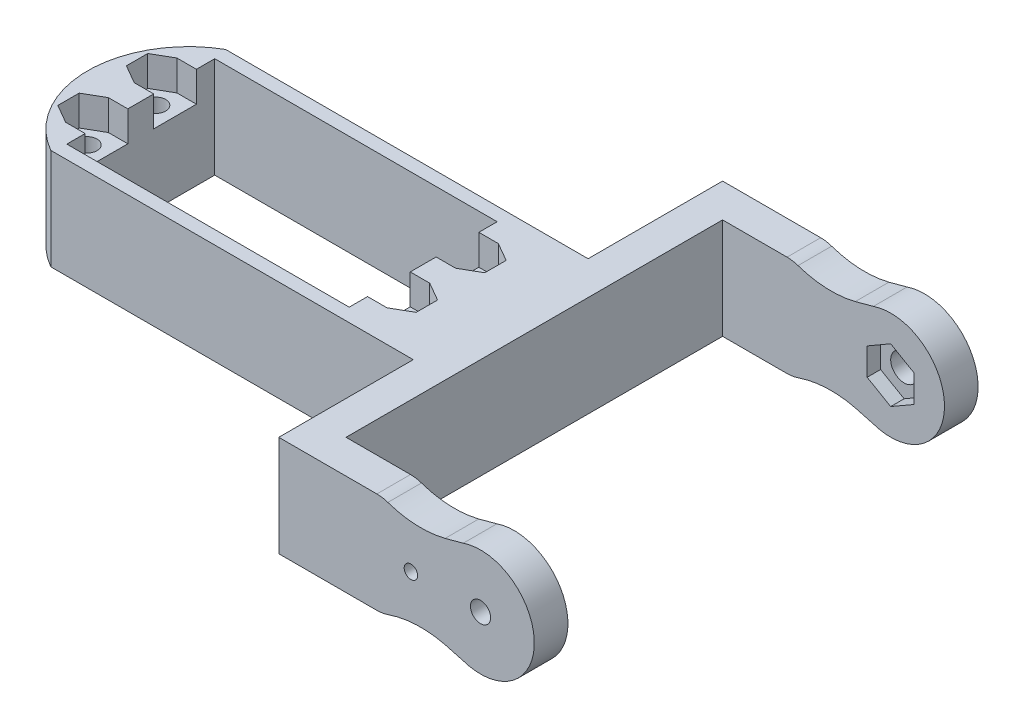
from build123d import *

# Parameters (mm, degrees)
ESQUISSE1_W                   = 80
ESQUISSE1_H                   = 26
BOSS_EXTRU_1_DEPTH            = 5
ESQUISSE4_W                   = 15
ESQUISSE4_H                   = 21
BOSS_EXTRU_2_DEPTH            = 23
ESQUISSE6_R                   = 1.9
ENL_V_MAT_EXTRU_1_DEPTH       = 23
ESQUISSE7_R                   = 2.5
ENL_V_MAT_EXTRU_2_DEPTH       = 33
ESQUISSE8_W                   = 23.844388633
ESQUISSE8_H                   = 15
ENL_V_MAT_EXTRU_3_DEPTH       = 20
ENL_V_MAT_EXTRU_4_DEPTH       = 20
ENL_V_MAT_EXTRU_5_DEPTH       = 25
ENL_V_MAT_EXTRU_7_DEPTH       = 25
ENL_V_MAT_EXTRU_8_DEPTH       = 1
BOSS_EXTRU_3_DEPTH            = 2
ESQUISSE15_R                  = 1.5
ENL_V_MAT_EXTRU_9_DEPTH       = 19
ENL_V_MAT_EXTRU_10_DEPTH      = 19
ESQUISSE17_W                  = 42
ESQUISSE17_H                  = 22
ENL_V_MAT_EXTRU_11_DEPTH      = 19
ENL_V_MAT_EXTRU_12_DEPTH      = 2
BOSS_EXTRU_4_DEPTH            = 22
BOSS_EXTRU_5_DEPTH            = 10
ESQUISSE25_R                  = 8
ENL_V_MAT_EXTRU_13_DEPTH      = 5
ESQUISSE26_R                  = 6
ENL_V_MAT_EXTRU_14_DEPTH      = 5
ENL_V_MAT_EXTRU_15_DEPTH      = 1
BOSS_EXTRU_6_DEPTH            = 2
ENL_V_MAT_EXTRU_16_DEPTH      = 25
ENL_V_MAT_EXTRU_16_DEPTH_BACK = 25
BOSS_EXTRU_7_START            = -5
BOSS_EXTRU_7_DEPTH            = 5
BOSS_EXTRU_8_DEPTH            = 23
BOSS_EXTRU_8_DEPTH_BACK       = 43
BOSS_EXTRU_10_DEPTH           = 45
BOSS_EXTRU_10_DEPTH_BACK      = 3
BOSS_EXTRU_12_DEPTH           = 5
ENL_V_START                   = -45
ENL_V_MAT_EXTRU_18_DEPTH      = 45
ESQUISSE41_W                  = 5
ESQUISSE41_H                  = 12
BOSS_EXTRU_13_DEPTH           = 37
ENL_V_MAT_EXTRU_19_DEPTH      = 2
ESQUISSE43_R                  = 2
ENL_V_MAT_EXTRU_20_DEPTH      = 18
ESQUISSE44_W                  = 24.601862261
ESQUISSE44_H                  = 37.157295415
ENL_V_MAT_EXTRU_21_DEPTH      = 18
BOSS_EXTRU_14_START           = -5
ESQUISSE45_R                  = 1.5
ESQUISSE45_R_2                = 1
BOSS_EXTRU_14_DEPTH           = 5
ENL_V_START_2                 = -29
ENL_V_MAT_EXTRU_22_DEPTH      = 29
ESQUISSE47_W                  = 0.149289857
ESQUISSE47_H                  = 9
ENL_V_MAT_EXTRU_23_DEPTH      = 1
ENL_V_MAT_EXTRU_24_DEPTH      = 21
ENL_V_MAT_EXTRU_24_DEPTH_BACK = 15
ESQUISSE48_W                  = 0.149289857
ESQUISSE48_H                  = 1
ENL_V_MAT_EXTRU_25_DEPTH      = 21
BOSS_EXTRU_15_DEPTH           = 12
ENL_V_MAT_EXTRU_26_DEPTH      = 13
ENL_V_MAT_EXTRU_26_DEPTH_BACK = 2
ENL_V_MAT_EXTRU_27_DEPTH      = 38
ENL_V_MAT_EXTRU_27_DEPTH_BACK = 40
ESQUISSE52_W                  = 78.402047569
ESQUISSE52_H                  = 75.386584202
ESQUISSE55_R                  = 1.5
ESQUISSE55_W                  = 42
ESQUISSE55_H                  = 22
BOSS_EXTRU_16_DEPTH           = 12
ENL_V_MAT_EXTRU_28_DEPTH      = 3
BOSS_EXTRU_17_DEPTH           = 2
ESQUISSE59_W                  = 4.103564956
ESQUISSE59_H                  = 6.350852962
ESQUISSE59_W_2                = 5.956787839
ESQUISSE59_W_3                = 5.294922523
ESQUISSE59_W_4                = 3.971191892
ENL_V_MAT_EXTRU_29_DEPTH      = 5
ESQUISSE60_W                  = 42
ESQUISSE60_H                  = 22
BOSS_EXTRU_18_DEPTH           = 5
BOSS_EXTRU_19_DEPTH           = 26
ESQUISSE62_R                  = 1.5
ENL_V_MAT_EXTRU_32_DEPTH      = 17
ESQUISSE64_W                  = 51.968203965
ESQUISSE64_H                  = 62.120932554
ENL_V_MAT_EXTRU_34_DEPTH      = 19
ESQUISSE66_R                  = 1.5
ESQUISSE66_R_2                = 1
BOSS_EXTRU_20_DEPTH           = 5
ESQUISSE68_W                  = 82.664548654
ESQUISSE68_H                  = 108.237034928
ENL_V_MAT_EXTRU_35_DEPTH      = 5
ESQUISSE69_R                  = 2
BOSS_EXTRU_21_DEPTH           = 5
ENL_V_MAT_EXTRU_36_DEPTH      = 2
BOSS_EXTRU_22_DEPTH           = 5
BOSS_EXTRU_24_START           = -5
ESQUISSE74_R                  = 5.859918964
BOSS_EXTRU_24_DEPTH           = 5
ESQUISSE75_W                  = 5
ESQUISSE75_H                  = 15
BOSS_EXTRU_25_DEPTH           = 59
BOSS_EXTRU_26_START           = 1.5
ESQUISSE76_R                  = 1.5
ESQUISSE76_W                  = 42
ESQUISSE76_H                  = 22
BOSS_EXTRU_26_DEPTH           = 1.5
ESQUISSE77_W                  = 87.209604184
ESQUISSE77_H                  = 26.905497246
ENL_V_MAT_EXTRU_37_DEPTH      = 51.5


with BuildPart() as part:
    # Esquisse1 → Boss.-Extru.1 (new body)
    with BuildSketch(Plane.XY):
        with Locations((16.761307699, -3.439862543)):
            Rectangle(ESQUISSE1_W, ESQUISSE1_H)
    extrude(amount=BOSS_EXTRU_1_DEPTH)

    # Esquisse4 → Boss.-Extru.2 (add)
    with BuildSketch(Plane(origin=(0, 0, 0), x_dir=(-1, 0, 0), z_dir=(0, 0, -1))):
        with Locations((30.738692301, -3.439862543)):
            Rectangle(ESQUISSE4_W, ESQUISSE4_H)
    extrude(amount=-BOSS_EXTRU_2_DEPTH)

    # Esquisse6 → Enlèv. mat.-Extru.1 (cut)
    with BuildSketch(Plane.XZ.offset(13.939862543)):
        with Locations((-28.738692301, 5)):
            Circle(ESQUISSE6_R)
    extrude(amount=-ENL_V_MAT_EXTRU_1_DEPTH, mode=Mode.SUBTRACT)

    # Esquisse7 → Enlèv. mat.-Extru.2 (cut)
    with BuildSketch(Plane.XY.offset(23)):
        with Locations((-33.238692301, -3.439862543)):
            Circle(ESQUISSE7_R)
    extrude(amount=-ENL_V_MAT_EXTRU_2_DEPTH, mode=Mode.SUBTRACT)

    # Esquisse8 → Enlèv. mat.-Extru.3 (cut)
    with BuildSketch(Plane(origin=(0, 0, 0), x_dir=(-1, 0, 0), z_dir=(0, 0, -1))):
        with Locations((38.160886617, -3.439862543)):
            Rectangle(ESQUISSE8_W, ESQUISSE8_H)
    extrude(amount=-ENL_V_MAT_EXTRU_3_DEPTH, mode=Mode.SUBTRACT)

    # Esquisse9 → Enlèv. mat.-Extru.4 (cut)
    with BuildSketch(Plane(origin=(0, 0, 0), x_dir=(-1, 0, 0), z_dir=(0, 0, -1))):
        with BuildLine():
            Line((23.238692301, 7.060137457), (23.238692301, 9.560137457))
            Line((23.238692301, 9.560137457), (17.813492819, 9.560137457))
            ThreePointArc((17.813492819, 9.560137457), (20.800246467, 8.905073311), (23.238692301, 7.060137457))
        make_face()
        with BuildLine():
            Line((17.813492819, -16.439862543), (23.238692301, -16.439862543))
            Line((23.238692301, -16.439862543), (23.238692301, -13.939862543))
            ThreePointArc((23.238692301, -13.939862543), (20.800246467, -15.784798397), (17.813492819, -16.439862543))
        make_face()
    extrude(amount=-ENL_V_MAT_EXTRU_4_DEPTH, mode=Mode.SUBTRACT)

    # Esquisse10 → Enlèv. mat.-Extru.5 (cut)
    with BuildSketch(Plane.XZ.offset(13.939862543)):
        with BuildLine():
            Line((-23.238692301, 21.5), (-23.238692301, 23))
            Line((-23.238692301, 23), (-24.738692301, 23))
            ThreePointArc((-24.738692301, 23), (-23.678032129, 22.560660172), (-23.238692301, 21.5))
        make_face()
    extrude(amount=-ENL_V_MAT_EXTRU_5_DEPTH, mode=Mode.SUBTRACT)

    # Esquisse12 → Enlèv. mat.-Extru.7 (cut)
    with BuildSketch(Plane.XZ.offset(13.939862543)):
        with BuildLine():
            Line((-38.238692301, 23), (-36.738692301, 23))
            ThreePointArc((-36.738692301, 23), (-37.799352472, 22.560660172), (-38.238692301, 21.5))
            Line((-38.238692301, 21.5), (-38.238692301, 23))
        make_face()
    extrude(amount=-ENL_V_MAT_EXTRU_7_DEPTH, mode=Mode.SUBTRACT)

    # Esquisse13 → Enlèv. mat.-Extru.8 (cut)
    with BuildSketch(Plane(origin=(0, 7.060137457, 0), x_dir=(1, 0, 0), z_dir=(0, 1, 0))):
        Polygon((-30.759418243, -1.5), (-32.780144185, -5), (-30.759418243, -8.5), (-26.717966358, -8.5), (-24.697240416, -5), (-26.717966358, -1.5), align=None)
    extrude(amount=-ENL_V_MAT_EXTRU_8_DEPTH, mode=Mode.SUBTRACT)

    # Esquisse14 → Boss.-Extru.3 (add)
    with BuildSketch(Plane(origin=(0, 7.060137457, 0), x_dir=(1, 0, 0), z_dir=(0, 1, 0))):
        Polygon((-25.851940955, 0), (-31.625443646, 0), (-34.512194992, -5), (-31.625443646, -10), (-25.851940955, -10), (-23.238692301, -5.473720558), (-23.238692301, -4.526279442), align=None)
        Polygon((-30.759418243, -1.5), (-32.780144185, -5), (-30.759418243, -8.5), (-26.717966358, -8.5), (-24.697240416, -5), (-26.717966358, -1.5), align=None, mode=Mode.SUBTRACT)
    extrude(amount=BOSS_EXTRU_3_DEPTH)

    # Esquisse15 → Enlèv. mat.-Extru.9 (cut)
    with BuildSketch(Plane(origin=(0, 0, 0), x_dir=(-1, 0, 0), z_dir=(0, 0, -1))):
        with Locations((-51.761307699, -8.539862543)):
            Circle(ESQUISSE15_R)
        with Locations((-51.761307699, 1.660137457)):
            Circle(ESQUISSE15_R)
        with Locations((-3.961307699, -8.539862543)):
            Circle(ESQUISSE15_R)
        with Locations((-3.961307699, 1.660137457)):
            Circle(ESQUISSE15_R)
    extrude(amount=-ENL_V_MAT_EXTRU_9_DEPTH, mode=Mode.SUBTRACT)

    # Esquisse16 → Enlèv. mat.-Extru.10 (cut)
    with BuildSketch(Plane(origin=(0, 0, 0), x_dir=(-1, 0, 0), z_dir=(0, 0, -1))):
        with BuildLine():
            Line((-43.376442757, 11.472928569), (-43.376442757, 11.560137457))
            Line((-43.376442757, 11.560137457), (-70.792344678, 11.560137457))
            Line((-70.792344678, 11.560137457), (-70.792344678, -43.134117635))
            Line((-70.792344678, -43.134117635), (-43.376442757, -43.134117635))
            Line((-43.376442757, -43.134117635), (-43.376442757, -18.352653655))
            ThreePointArc((-43.376442757, -18.352653655), (-56.761307699, -3.439862543), (-43.376442757, 11.472928569))
        make_face()
    extrude(amount=-ENL_V_MAT_EXTRU_10_DEPTH, mode=Mode.SUBTRACT)

    # Esquisse17 → Enlèv. mat.-Extru.11 (cut)
    with BuildSketch(Plane.XY.offset(5)):
        with Locations((27.861307699, -3.439862543)):
            Rectangle(ESQUISSE17_W, ESQUISSE17_H)
    extrude(amount=-ENL_V_MAT_EXTRU_11_DEPTH, mode=Mode.SUBTRACT)

    # Esquisse18 → Enlèv. mat.-Extru.12 (cut)
    with BuildSketch(Plane(origin=(0, 0, 0), x_dir=(-1, 0, 0), z_dir=(0, 0, -1))):
        Polygon((-49.011307699, 3.247850697), (-51.761307699, 4.835563938), (-54.511307699, 3.247850697), (-54.511307699, 0.072424217), (-51.761307699, -1.515289023), (-49.011307699, 0.072424217), (-46.261307699, 1.660137457), align=None)
        Polygon((-49.011307699, -6.952149303), (-51.761307699, -5.364436062), (-54.511307699, -6.952149303), (-54.511307699, -10.127575783), (-51.761307699, -11.715289023), (-49.011307699, -10.127575783), (-46.261307699, -8.539862543), align=None)
        Polygon((-6.711307699, 0.072424217), (-9.461307699, 1.660137457), (-6.711307699, 3.247850697), (-3.961307699, 4.835563938), (-1.211307699, 3.247850697), (-1.211307699, 0.072424217), (-3.961307699, -1.515289023), align=None)
        Polygon((-9.461307699, -8.539862543), (-6.711307699, -6.952149303), (-3.961307699, -5.364436062), (-1.211307699, -6.952149303), (-1.211307699, -10.127575783), (-3.961307699, -11.715289023), (-6.711307699, -10.127575783), align=None)
    extrude(amount=-ENL_V_MAT_EXTRU_12_DEPTH, mode=Mode.SUBTRACT)

    # Esquisse19 → Boss.-Extru.4 (add)
    with BuildSketch(Plane(origin=(0, 0, 0), x_dir=(-1, 0, 0), z_dir=(0, 0, -1))):
        with BuildLine():
            Line((-12.861307699, -16.439862543), (-22.861307699, -16.439862543))
            ThreePointArc((-22.861307699, -16.439862543), (-23.568414481, -16.146969324), (-23.861307699, -15.439862543))
            Line((-23.861307699, -15.439862543), (-23.861307699, -14.439862543))
            Line((-23.861307699, -14.439862543), (-11.861307699, -14.439862543))
            Line((-11.861307699, -14.439862543), (-11.861307699, -15.439862543))
            ThreePointArc((-11.861307699, -15.439862543), (-12.154200918, -16.146969324), (-12.861307699, -16.439862543))
        make_face()
        with BuildLine():
            Line((-23.861307699, 8.560137457), (-23.861307699, 7.560137457))
            Line((-23.861307699, 7.560137457), (-11.861307699, 7.560137457))
            Line((-11.861307699, 7.560137457), (-11.861307699, 8.560137457))
            ThreePointArc((-11.861307699, 8.560137457), (-12.154200918, 9.267244238), (-12.861307699, 9.560137457))
            Line((-12.861307699, 9.560137457), (-22.861307699, 9.560137457))
            ThreePointArc((-22.861307699, 9.560137457), (-23.568414481, 9.267244238), (-23.861307699, 8.560137457))
        make_face()
    extrude(amount=BOSS_EXTRU_4_DEPTH)

    # Esquisse23 → Boss.-Extru.5 (add)
    with BuildSketch(Plane(origin=(0, 0, -22), x_dir=(-1, 0, 0), z_dir=(0, 0, -1))):
        with BuildLine():
            Line((-23.861307699, 8.560137457), (-23.861307699, 7.560137457))
            ThreePointArc((-23.861307699, 7.560137457), (-24.290279557, 5.125218133), (-25.525541276, 2.983495121))
            ThreePointArc((-25.525541276, 2.983495121), (-27.861307699, -3.439862543), (-25.525541276, -9.863220207))
            ThreePointArc((-25.525541276, -9.863220207), (-24.290279557, -12.004943218), (-23.861307699, -14.439862543))
            Line((-23.861307699, -14.439862543), (-23.861307699, -15.439862543))
            ThreePointArc((-23.861307699, -15.439862543), (-23.568414481, -16.146969324), (-22.861307699, -16.439862543))
            Line((-22.861307699, -16.439862543), (-12.861307699, -16.439862543))
            ThreePointArc((-12.861307699, -16.439862543), (-12.154200918, -16.146969324), (-11.861307699, -15.439862543))
            Line((-11.861307699, -15.439862543), (-11.861307699, -14.439862543))
            ThreePointArc((-11.861307699, -14.439862543), (-11.432335842, -12.004943218), (-10.197074123, -9.863220207))
            ThreePointArc((-10.197074123, -9.863220207), (-7.861307699, -3.439862543), (-10.197074123, 2.983495121))
            ThreePointArc((-10.197074123, 2.983495121), (-11.432335842, 5.125218133), (-11.861307699, 7.560137457))
            Line((-11.861307699, 7.560137457), (-11.861307699, 8.560137457))
            ThreePointArc((-11.861307699, 8.560137457), (-12.154200918, 9.267244238), (-12.861307699, 9.560137457))
            Line((-12.861307699, 9.560137457), (-22.861307699, 9.560137457))
            ThreePointArc((-22.861307699, 9.560137457), (-23.568414481, 9.267244238), (-23.861307699, 8.560137457))
        make_face()
    extrude(amount=BOSS_EXTRU_5_DEPTH)

    # Esquisse25 → Enlèv. mat.-Extru.13 (cut)
    with BuildSketch(Plane(origin=(0, 0, -32), x_dir=(-1, 0, 0), z_dir=(0, 0, -1))):
        with Locations((-17.861307699, -3.439862543)):
            Circle(ESQUISSE25_R)
    extrude(amount=-ENL_V_MAT_EXTRU_13_DEPTH, mode=Mode.SUBTRACT)

    # Esquisse26 → Enlèv. mat.-Extru.14 (cut)
    with BuildSketch(Plane(origin=(0, 0, -27), x_dir=(-1, 0, 0), z_dir=(0, 0, -1))):
        with Locations((-17.861307699, -3.439862543)):
            Circle(ESQUISSE26_R)
    extrude(amount=-ENL_V_MAT_EXTRU_14_DEPTH, mode=Mode.SUBTRACT)

    # Esquisse29 → Enlèv. mat.-Extru.15 (cut)
    with BuildSketch(Plane.XZ.offset(13.939862543)):
        Polygon((-26.717966358, 1.5), (-24.697240416, 5), (-26.717966358, 8.5), (-30.759418243, 8.5), (-32.780144185, 5), (-30.759418243, 1.5), align=None)
    extrude(amount=-ENL_V_MAT_EXTRU_15_DEPTH, mode=Mode.SUBTRACT)

    # Esquisse32 → Boss.-Extru.6 (add)
    with BuildSketch(Plane.XZ.offset(13.939862543)):
        Polygon((-25.851940955, 0), (-23.238692301, 4.526279442), (-23.238692301, 5.473720558), (-25.851940955, 10), (-31.625443646, 10), (-34.512194992, 5), (-31.625443646, 0), align=None)
        Polygon((-26.717966358, 1.5), (-24.697240416, 5), (-26.717966358, 8.5), (-30.759418243, 8.5), (-32.780144185, 5), (-30.759418243, 1.5), align=None, mode=Mode.SUBTRACT)
    extrude(amount=BOSS_EXTRU_6_DEPTH)

    # Esquisse33 → Enlèv. mat.-Extru.16 (cut, two sides: drawn at the far end of the back side and taken through both)
    with BuildSketch(Plane.XY.offset(5).offset(-ENL_V_MAT_EXTRU_16_DEPTH_BACK)):
        with BuildLine():
            Line((6.477992926, -16.439862543), (-54.7028229, -16.439862543))
            Line((-54.7028229, -16.439862543), (-54.7028229, 9.560137457))
            Line((-54.7028229, 9.560137457), (6.477992926, 9.560137457))
            ThreePointArc((6.477992926, 9.560137457), (-1.038692301, -3.439862543), (6.477992926, -16.439862543))
        make_face()
    extrude(amount=ENL_V_MAT_EXTRU_16_DEPTH + ENL_V_MAT_EXTRU_16_DEPTH_BACK, mode=Mode.SUBTRACT)

    # Esquisse34 → Boss.-Extru.7 (add)
    with BuildSketch(Plane.XY.offset(5).offset(BOSS_EXTRU_7_START)):
        with BuildLine():
            Line((59.244622473, -16.439862543), (49.244622473, -16.439862543))
            ThreePointArc((49.244622473, -16.439862543), (56.761307699, -3.439862543), (49.244622473, 9.560137457))
            Line((49.244622473, 9.560137457), (59.244622473, 9.560137457))
            Line((59.244622473, 9.560137457), (59.244622473, -16.439862543))
        make_face()
    extrude(amount=BOSS_EXTRU_7_DEPTH)

    # Esquisse35 → Boss.-Extru.8 (add, two sides: drawn at the far end of the back side and taken through both)
    with BuildSketch(Plane.XY.offset(5).offset(-BOSS_EXTRU_8_DEPTH_BACK)):
        with BuildLine():
            Line((62.744622473, -9.439862543), (59.244622473, -9.439862543))
            Line((59.244622473, -9.439862543), (59.244622473, 2.560137457))
            Line((59.244622473, 2.560137457), (62.744622473, 2.560137457))
            ThreePointArc((62.744622473, 2.560137457), (63.805282645, 2.120797629), (64.244622473, 1.060137457))
            Line((64.244622473, 1.060137457), (64.244622473, -7.939862543))
            ThreePointArc((64.244622473, -7.939862543), (63.805282645, -9.000522715), (62.744622473, -9.439862543))
        make_face()
    extrude(amount=BOSS_EXTRU_8_DEPTH + BOSS_EXTRU_8_DEPTH_BACK)

    # Esquisse36 → Boss.-Extru.10 (add, two sides: drawn at the far end of the back side and taken through both)
    with BuildSketch(Plane(origin=(64.244622473, 0, 0), x_dir=(0, 0, -1), z_dir=(1, 0, 0)).offset(-BOSS_EXTRU_10_DEPTH_BACK)):
        with BuildLine():
            Line((33.5, 2.560137457), (38, 2.560137457))
            Line((38, 2.560137457), (38, -9.439862543))
            Line((38, -9.439862543), (33.5, -9.439862543))
            ThreePointArc((33.5, -9.439862543), (32.439339828, -9.000522715), (32, -7.939862543))
            Line((32, -7.939862543), (32, 1.060137457))
            ThreePointArc((32, 1.060137457), (32.439339828, 2.120797629), (33.5, 2.560137457))
        make_face()
        with BuildLine():
            Line((-28, 2.560137457), (-28, -9.439862543))
            Line((-28, -9.439862543), (-23.5, -9.439862543))
            ThreePointArc((-23.5, -9.439862543), (-22.439339828, -9.000522715), (-22, -7.939862543))
            Line((-22, -7.939862543), (-22, 1.060137457))
            ThreePointArc((-22, 1.060137457), (-22.439339828, 2.120797629), (-23.5, 2.560137457))
            Line((-23.5, 2.560137457), (-28, 2.560137457))
        make_face()
    extrude(amount=BOSS_EXTRU_10_DEPTH + BOSS_EXTRU_10_DEPTH_BACK)

    # Esquisse39 → Boss.-Extru.12 (add)
    with BuildSketch(Plane(origin=(0, 0, -38), x_dir=(-1, 0, 0), z_dir=(0, 0, -1))):
        with BuildLine():
            Line((-77.712666699, 2.560137457), (-100.293632227, 2.560137457))
            add(Edge.make_bspline(
                [(-106.908505284, 4.211448226), (-104.669885683, 3.527947334), (-102.465356223, 2.979290843), (-100.293632227, 2.560137457)],
                knots=[0, 0, 0, 0, 0.141370549, 0.141370549, 0.141370549, 0.141370549], degree=3))
            ThreePointArc((-106.908505284, 4.211448226), (-117.244622473, -3.439862543), (-106.908505284, -11.091173312))
            add(Edge.make_bspline(
                [(-106.908505284, -11.091173312), (-104.669885683, -10.40767242), (-102.465356223, -9.859015928), (-100.293632227, -9.439862543)],
                knots=[0, 0, 0, 0, 0.141370549, 0.141370549, 0.141370549, 0.141370549], degree=3))
            Line((-100.293632227, -9.439862543), (-77.712666699, -9.439862543))
            Line((-77.712666699, -9.439862543), (-77.712666699, 2.560137457))
        make_face()
    extrude(amount=-BOSS_EXTRU_12_DEPTH)

    # Esquisse40 → Enlèv. mat.-Extru.18 (cut)
    with BuildSketch(Plane(origin=(109.244622473, 0, 0), x_dir=(0, 0, -1), z_dir=(1, 0, 0)).offset(ENL_V_START)):
        with BuildLine():
            Line((33, -9.354076105), (33, 2.474351019))
            ThreePointArc((33, 2.474351019), (32.275255129, 1.926162861), (32, 1.060137457))
            Line((32, 1.060137457), (32, -7.939862543))
            ThreePointArc((32, -7.939862543), (32.275255129, -8.805887947), (33, -9.354076105))
        make_face()
    extrude(amount=ENL_V_MAT_EXTRU_18_DEPTH, mode=Mode.SUBTRACT)

    # Esquisse41 → Boss.-Extru.13 (add)
    with BuildSketch(Plane.ZY.offset(-59.244622473)):
        with Locations((-35.5, -3.439862543)):
            Rectangle(ESQUISSE41_W, ESQUISSE41_H)
    extrude(amount=-BOSS_EXTRU_13_DEPTH)

    # Esquisse42 → Enlèv. mat.-Extru.19 (cut)
    with BuildSketch(Plane.XY.offset(-33)):
        Polygon((105.744622473, -5.460588485), (109.244622473, -7.481314427), (112.744622473, -5.460588485), (112.744622473, -1.419136601), (109.244622473, 0.601589341), (105.744622473, -1.419136601), align=None)
    extrude(amount=-ENL_V_MAT_EXTRU_19_DEPTH, mode=Mode.SUBTRACT)

    # Esquisse43 → Enlèv. mat.-Extru.20 (cut)
    with BuildSketch(Plane(origin=(0, 0, -38), x_dir=(-1, 0, 0), z_dir=(0, 0, -1))):
        with Locations((-109.244622473, -3.439862543)):
            Circle(ESQUISSE43_R)
    extrude(amount=-ENL_V_MAT_EXTRU_20_DEPTH, mode=Mode.SUBTRACT)

    # Esquisse44 → Enlèv. mat.-Extru.21 (cut)
    with BuildSketch(Plane.XY.offset(28)):
        with Locations((105.694843461, -5.730380753)):
            Rectangle(ESQUISSE44_W, ESQUISSE44_H)
    extrude(amount=-ENL_V_MAT_EXTRU_21_DEPTH, mode=Mode.SUBTRACT)

    # Esquisse45 → Boss.-Extru.14 (add)
    with BuildSketch(Plane.XY.offset(28).offset(BOSS_EXTRU_14_START)):
        with BuildLine():
            Line((100.293632227, 2.560137457), (62.744622473, 2.560137457))
            ThreePointArc((62.744622473, 2.560137457), (62.998275441, 2.538535297), (63.244622473, 2.474351019))
            Line((63.244622473, 2.474351019), (64.244622473, 2.474351019))
            Line((64.244622473, 2.474351019), (64.244622473, -9.354076105))
            Line((64.244622473, -9.354076105), (63.244622473, -9.354076105))
            ThreePointArc((63.244622473, -9.354076105), (62.998275441, -9.418260382), (62.744622473, -9.439862543))
            Line((62.744622473, -9.439862543), (100.293632227, -9.439862543))
            add(Edge.make_bspline(
                [(100.293632227, -9.439862543), (102.465356223, -9.859015928), (104.669885683, -10.40767242), (106.908505284, -11.091173312)],
                knots=[0, 0, 0, 0, 0.141370549, 0.141370549, 0.141370549, 0.141370549], degree=3))
            ThreePointArc((106.908505284, -11.091173312), (117.244622473, -3.439862543), (106.908505284, 4.211448226))
            add(Edge.make_bspline(
                [(106.908505284, 4.211448226), (104.669885683, 3.527947334), (102.465356223, 2.979290843), (100.293632227, 2.560137457)],
                knots=[0, 0, 0, 0, 0.141370549, 0.141370549, 0.141370549, 0.141370549], degree=3))
        make_face()
        with Locations((109.244622473, -3.439862543)):
            Circle(ESQUISSE45_R, mode=Mode.SUBTRACT)
        with Locations((98.894622473, -3.439862543)):
            Circle(ESQUISSE45_R_2, mode=Mode.SUBTRACT)
    extrude(amount=BOSS_EXTRU_14_DEPTH)

    # Esquisse46 → Enlèv. mat.-Extru.22 (cut)
    with BuildSketch(Plane(origin=(93.39391233, 0, 0), x_dir=(0, 0, -1), z_dir=(1, 0, 0)).offset(ENL_V_START_2)):
        with BuildLine():
            Line((-23, 2.474351019), (-23, -9.354076105))
            ThreePointArc((-23, -9.354076105), (-22.275255129, -8.805887947), (-22, -7.939862543))
            Line((-22, -7.939862543), (-22, 1.060137457))
            ThreePointArc((-22, 1.060137457), (-22.275255129, 1.926162861), (-23, 2.474351019))
        make_face()
    extrude(amount=ENL_V_MAT_EXTRU_22_DEPTH, mode=Mode.SUBTRACT)

    # Esquisse47 → Enlèv. mat.-Extru.23 (cut)
    with BuildSketch(Plane(origin=(0, 0, 22), x_dir=(-1, 0, 0), z_dir=(0, 0, -1))):
        with Locations((-64.319267402, -3.439862543)):
            Rectangle(ESQUISSE47_W, ESQUISSE47_H)
    extrude(amount=-ENL_V_MAT_EXTRU_23_DEPTH, mode=Mode.SUBTRACT)

    # Esquisse48 → Enlèv. mat.-Extru.24 (cut, two sides: drawn at the far end of the back side and taken through both)
    with BuildSketch(Plane.XZ.offset(-1.060137457).offset(-ENL_V_MAT_EXTRU_24_DEPTH_BACK)):
        with Locations((64.319267402, 22.5)):
            Rectangle(ESQUISSE48_W, ESQUISSE48_H)
    extrude(amount=ENL_V_MAT_EXTRU_24_DEPTH + ENL_V_MAT_EXTRU_24_DEPTH_BACK, mode=Mode.SUBTRACT)

    # Esquisse49 → Enlèv. mat.-Extru.25 (cut)
    with BuildSketch(Plane.XY.offset(5)):
        with BuildLine():
            Line((59.244622473, -9.439862543), (59.244622473, -16.439862543))
            Line((59.244622473, -16.439862543), (52.244622473, -16.439862543))
            ThreePointArc((52.244622473, -16.439862543), (57.194369941, -14.389610011), (59.244622473, -9.439862543))
        make_face()
        with BuildLine():
            Line((59.244622473, 9.560137457), (52.244622473, 9.560137457))
            ThreePointArc((52.244622473, 9.560137457), (57.194369941, 7.509884925), (59.244622473, 2.560137457))
            Line((59.244622473, 2.560137457), (59.244622473, 9.560137457))
        make_face()
    extrude(amount=-ENL_V_MAT_EXTRU_25_DEPTH, mode=Mode.SUBTRACT)

    # Esquisse50 → Boss.-Extru.15 (add)
    with BuildSketch(Plane(origin=(0, 2.560137457, 0), x_dir=(1, 0, 0), z_dir=(0, 1, 0))):
        with BuildLine():
            Line((59.244622473, 5.983314774), (59.244622473, -10.983314774))
            ThreePointArc((59.244622473, -10.983314774), (57.49215015, -6.752472323), (53.261307699, -5))
            Line((53.261307699, -5), (53.261307699, 0))
            ThreePointArc((53.261307699, 0), (57.49215015, 1.752472323), (59.244622473, 5.983314774))
        make_face()
    extrude(amount=-BOSS_EXTRU_15_DEPTH)

    # Esquisse51 → Enlèv. mat.-Extru.26 (cut, two sides: drawn at the far end of the back side and taken through both)
    with BuildSketch(Plane(origin=(0, 0, 0), x_dir=(-1, 0, 0), z_dir=(0, 0, -1)).offset(-ENL_V_MAT_EXTRU_26_DEPTH_BACK)):
        Polygon((-49.011307699, -10.127575783), (-49.011307699, -6.952149303), (-51.761307699, -5.364436062), (-54.511307699, -6.952149303), (-54.511307699, -10.127575783), (-51.761307699, -11.715289023), align=None)
        Polygon((-49.011307699, 3.247850697), (-51.761307699, 4.835563938), (-54.511307699, 3.247850697), (-54.511307699, 0.072424217), (-51.761307699, -1.515289023), (-49.011307699, 0.072424217), align=None)
    extrude(amount=ENL_V_MAT_EXTRU_26_DEPTH + ENL_V_MAT_EXTRU_26_DEPTH_BACK, mode=Mode.SUBTRACT)

    # Esquisse52 → Enlèv. mat.-Extru.27 (cut, two sides: drawn at the far end of the back side and taken through both)
    with BuildSketch(Plane(origin=(0, 2.560137457, 0), x_dir=(1, 0, 0), z_dir=(0, 1, 0)).offset(-ENL_V_MAT_EXTRU_27_DEPTH_BACK)):
        with Locations((20.043598689, 6.76994589)):
            Rectangle(ESQUISSE52_W, ESQUISSE52_H)
    extrude(amount=ENL_V_MAT_EXTRU_27_DEPTH + ENL_V_MAT_EXTRU_27_DEPTH_BACK, mode=Mode.SUBTRACT)

    # Esquisse55 → Boss.-Extru.16 (add)
    with BuildSketch(Plane.XZ.offset(9.439862543)):
        with BuildLine():
            Line((5.335858316, -18), (51.054100102, -18))
            Line((51.054100102, -18), (59.244622473, -18))
            Line((59.244622473, -18), (59.244622473, 8))
            Line((59.244622473, 8), (48.395806582, 8))
            Line((48.395806582, 8), (5.335858316, 8))
            ThreePointArc((5.335858316, 8), (-2.180826911, -5), (5.335858316, -18))
        make_face()
        with Locations(Location((50.619173089, -10.1, 0), (0, 0, 270))):
            Circle(ESQUISSE55_R, mode=Mode.SUBTRACT)
        with Locations(Location((50.619173089, 0.1, 0), (0, 0, 270))):
            Circle(ESQUISSE55_R, mode=Mode.SUBTRACT)
        with Locations(Location((2.819173089, 0.1, 0), (0, 0, 270))):
            Circle(ESQUISSE55_R, mode=Mode.SUBTRACT)
        with Locations(Location((2.819173089, -10.1, 0), (0, 0, 270))):
            Circle(ESQUISSE55_R, mode=Mode.SUBTRACT)
        with Locations((26.719173089, -5)):
            Rectangle(ESQUISSE55_W, ESQUISSE55_H, mode=Mode.SUBTRACT)
    extrude(amount=-BOSS_EXTRU_16_DEPTH)

    # Esquisse57 → Enlèv. mat.-Extru.28 (cut)
    with BuildSketch(Plane(origin=(0, 2.560137457, 0), x_dir=(1, 0, 0), z_dir=(0, 1, 0))):
        Polygon((47.869173089, 11.68771324), (45.119173089, 10.1), (47.869173089, 8.51228676), (50.619173089, 6.924573519), (53.369173089, 8.51228676), (53.369173089, 11.68771324), (50.619173089, 13.275426481), align=None)
        Polygon((47.869173089, 1.48771324), (45.119173089, -0.1), (47.869173089, -1.68771324), (50.619173089, -3.275426481), (53.369173089, -1.68771324), (53.369173089, 1.48771324), (50.619173089, 3.075426481), align=None)
        Polygon((5.569173089, -1.68771324), (8.319173089, -0.1), (5.569173089, 1.48771324), (2.819173089, 3.075426481), (0.069173089, 1.48771324), (0.069173089, -1.68771324), (2.819173089, -3.275426481), align=None)
        Polygon((5.569173089, 8.51228676), (8.319173089, 10.1), (5.569173089, 11.68771324), (2.819173089, 13.275426481), (0.069173089, 11.68771324), (0.069173089, 8.51228676), (2.819173089, 6.924573519), align=None)
    extrude(amount=-ENL_V_MAT_EXTRU_28_DEPTH, mode=Mode.SUBTRACT)

    # Esquisse58 → Boss.-Extru.17 (add)
    with BuildSketch(Plane(origin=(0, 2.560137457, 0), x_dir=(1, 0, 0), z_dir=(0, 1, 0))):
        with BuildLine():
            Line((59.244622473, 18), (5.335858316, 18))
            ThreePointArc((5.335858316, 18), (-2.180826911, 5), (5.335858316, -8))
            Line((5.335858316, -8), (59.244622473, -8))
            Line((59.244622473, -8), (59.244622473, 18))
        make_face()
        Polygon((53.369173089, -1.68771324), (53.369173089, 1.48771324), (50.619173089, 3.075426481), (47.719173089, 1.4011107), (47.719173089, 8.5988893), (50.619173089, 6.924573519), (53.369173089, 8.51228676), (53.369173089, 11.68771324), (50.619173089, 13.275426481), (47.719173089, 11.6011107), (47.719173089, 16), (5.719173089, 16), (5.719173089, 11.6011107), (2.819173089, 13.275426481), (0.069173089, 11.68771324), (0.069173089, 8.51228676), (2.819173089, 6.924573519), (5.719173089, 8.5988893), (5.719173089, 1.4011107), (2.819173089, 3.075426481), (0.069173089, 1.48771324), (0.069173089, -1.68771324), (2.819173089, -3.275426481), (5.719173089, -1.6011107), (5.719173089, -6), (47.719173089, -6), (47.719173089, -1.6011107), (50.619173089, -3.275426481), align=None, mode=Mode.SUBTRACT)
    extrude(amount=BOSS_EXTRU_17_DEPTH)

    # Esquisse59 → Enlèv. mat.-Extru.29 (cut)
    with BuildSketch(Plane(origin=(0, 4.560137457, 0), x_dir=(1, 0, 0), z_dir=(0, 1, 0))):
        with Locations((4.870955567, 10.1)):
            Rectangle(ESQUISSE59_W, ESQUISSE59_H)
        with Locations((5.797567008, -0.1)):
            Rectangle(ESQUISSE59_W_2, ESQUISSE59_H)
        with Locations((47.971711828, 10.1)):
            Rectangle(ESQUISSE59_W_3, ESQUISSE59_H)
        with Locations((48.633577143, -0.1)):
            Rectangle(ESQUISSE59_W_4, ESQUISSE59_H)
    extrude(amount=-ENL_V_MAT_EXTRU_29_DEPTH, mode=Mode.SUBTRACT)

    # Esquisse60 → Boss.-Extru.18 (add)
    with BuildSketch(Plane(origin=(0, 4.560137457, 0), x_dir=(1, 0, 0), z_dir=(0, 1, 0))):
        with BuildLine():
            Line((59.244622473, -8), (59.244622473, 18))
            Line((59.244622473, 18), (5.335858316, 18))
            ThreePointArc((5.335858316, 18), (-2.180826911, 5), (5.335858316, -8))
            Line((5.335858316, -8), (59.244622473, -8))
        make_face()
        with Locations((26.719173089, 5)):
            Rectangle(ESQUISSE60_W, ESQUISSE60_H, mode=Mode.SUBTRACT)
    extrude(amount=BOSS_EXTRU_18_DEPTH)

    # Esquisse61 → Boss.-Extru.19 (add)
    with BuildSketch(Plane.XY.offset(8)):
        with BuildLine():
            Line((59.244622473, 2.560137457), (62.744622473, 2.560137457))
            ThreePointArc((62.744622473, 2.560137457), (60.269748739, 3.585263723), (59.244622473, 6.060137457))
            Line((59.244622473, 6.060137457), (59.244622473, 2.560137457))
        make_face()
    extrude(amount=-BOSS_EXTRU_19_DEPTH)

    # Esquisse62 → Enlèv. mat.-Extru.32 (cut)
    with BuildSketch(Plane.XZ.offset(9.439862543)):
        with Locations(Location((2.819173089, -10.1, 0), (0, 0, 270))):
            Circle(ESQUISSE62_R)
        with Locations(Location((2.819173089, 0.1, 0), (0, 0, 270))):
            Circle(ESQUISSE62_R)
        with Locations(Location((50.619173089, -10.1, 0), (0, 0, 270))):
            Circle(ESQUISSE62_R)
        with Locations(Location((50.619173089, 0.1, 0), (0, 0, 270))):
            Circle(ESQUISSE62_R)
    extrude(amount=-ENL_V_MAT_EXTRU_32_DEPTH, mode=Mode.SUBTRACT)

    # Esquisse64 → Enlèv. mat.-Extru.34 (cut)
    with BuildSketch(Plane.XY.offset(28)):
        with Locations((98.314892284, -15.996875281)):
            Rectangle(ESQUISSE64_W, ESQUISSE64_H)
    extrude(amount=-ENL_V_MAT_EXTRU_34_DEPTH, mode=Mode.SUBTRACT)

    # Esquisse68 → Enlèv. mat.-Extru.35 (cut)
    with BuildSketch(Plane(origin=(0, 0, -38), x_dir=(-1, 0, 0), z_dir=(0, 0, -1))):
        with Locations((-111.353060754, 3.198224101)):
            Rectangle(ESQUISSE68_W, ESQUISSE68_H)
    extrude(amount=-ENL_V_MAT_EXTRU_35_DEPTH, mode=Mode.SUBTRACT)

    # Esquisse69 → Boss.-Extru.21 (add)
    with BuildSketch(Plane(origin=(0, 0, -38), x_dir=(-1, 0, 0), z_dir=(0, 0, -1))):
        with BuildLine():
            Line((-72.330790301, -9.439862543), (-66.14609199, -9.439862543))
            Line((-66.14609199, -9.439862543), (-66.14609199, 2.560137457))
            Line((-66.14609199, 2.560137457), (-72.330790301, 2.560137457))
            Line((-72.330790301, 2.560137457), (-80.043112621, 2.560137457))
            add(Edge.make_bspline(
                [(-80.043112621, 2.560137457), (-82.21943214, 2.954736026), (-84.430017675, 3.478458927), (-86.676214149, 4.136632602)],
                knots=[0, 0, 0, 0, 0.141370549, 0.141370549, 0.141370549, 0.141370549], degree=3))
            ThreePointArc((-86.676214149, 4.136632602), (-97.244622473, -3.439862543), (-86.676214149, -11.016357688))
            add(Edge.make_bspline(
                [(-86.676214149, -11.016357688), (-84.430017675, -10.358184012), (-82.21943214, -9.834461112), (-80.043112621, -9.439862543)],
                knots=[0, 0, 0, 0, 0.141370549, 0.141370549, 0.141370549, 0.141370549], degree=3))
            Line((-80.043112621, -9.439862543), (-72.330790301, -9.439862543))
        make_face()
        with Locations((-89.244622473, -3.439862543)):
            Circle(ESQUISSE69_R, mode=Mode.SUBTRACT)
    extrude(amount=-BOSS_EXTRU_21_DEPTH)

    # Esquisse72 → Enlèv. mat.-Extru.36 (cut)
    with BuildSketch(Plane.XY.offset(-33)):
        Polygon((89.244622473, -7.481314427), (92.744622473, -5.460588485), (92.744622473, -1.419136601), (89.244622473, 0.601589341), (85.744622473, -1.419136601), (85.744622473, -5.460588485), align=None)
    extrude(amount=-ENL_V_MAT_EXTRU_36_DEPTH, mode=Mode.SUBTRACT)



with BuildPart() as body_2:
    # Esquisse66 → Boss.-Extru.20 (new body)
    with BuildSketch(Plane.XY.offset(28)):
        with BuildLine():
            Line((80.043112621, -9.439862543), (72.330790301, -9.439862543))
            Line((72.330790301, -9.439862543), (72.330790301, 2.560137457))
            Line((72.330790301, 2.560137457), (80.043112621, 2.560137457))
            add(Edge.make_bspline(
                [(86.676214149, 4.136632602), (84.430017675, 3.478458927), (82.21943214, 2.954736026), (80.043112621, 2.560137457)],
                knots=[0, 0, 0, 0, 0.141370549, 0.141370549, 0.141370549, 0.141370549], degree=3))
            ThreePointArc((86.676214149, 4.136632602), (97.244622473, -3.439862543), (86.676214149, -11.016357688))
            add(Edge.make_bspline(
                [(86.676214149, -11.016357688), (84.430017675, -10.358184012), (82.21943214, -9.834461112), (80.043112621, -9.439862543)],
                knots=[0, 0, 0, 0, 0.141370549, 0.141370549, 0.141370549, 0.141370549], degree=3))
        make_face()
        with Locations((89.244622473, -3.439862543)):
            Circle(ESQUISSE66_R, mode=Mode.SUBTRACT)
        with Locations((78.894622473, -3.439862543)):
            Circle(ESQUISSE66_R_2, mode=Mode.SUBTRACT)
    extrude(amount=-BOSS_EXTRU_20_DEPTH)


with BuildPart() as part_1:
    add(part.part)

    add(body_2.part)  # Boss.-Extru.22 merges body 2
    # Esquisse73 → Boss.-Extru.22 (add)
    with BuildSketch(Plane.XY.offset(28)):
        with BuildLine():
            Line((59.244622473, 4.060137457), (59.244622473, 2.560137457))
            Line((59.244622473, 2.560137457), (72.330790301, 2.560137457))
            Line((72.330790301, 2.560137457), (80.043112621, 2.560137457))
            add(Edge.make_bspline(
                [(83.978289898, 3.406175446), (82.654157719, 3.077375114), (81.342527383, 2.795740364), (80.043112621, 2.560137457)],
                knots=[0.056962457, 0.056962457, 0.056962457, 0.056962457, 0.141370549, 0.141370549, 0.141370549, 0.141370549], degree=3))
            ThreePointArc((83.978289898, 3.406175446), (79.694518247, 2.978989604), (75.465839174, 3.786120692))
            ThreePointArc((75.465839174, 3.786120692), (74.661003733, 3.991157442), (73.833331145, 4.060137457))
            Line((73.833331145, 4.060137457), (59.244622473, 4.060137457))
        make_face()
        with BuildLine():
            Line((59.244622473, -9.439862543), (59.244622473, -10.939862543))
            Line((59.244622473, -10.939862543), (73.833331145, -10.939862543))
            ThreePointArc((73.833331145, -10.939862543), (74.661003733, -10.870882527), (75.465839174, -10.665845778))
            ThreePointArc((75.465839174, -10.665845778), (79.694518247, -9.85871469), (83.978289898, -10.285900532))
            add(Edge.make_bspline(
                [(80.043112621, -9.439862543), (81.342527383, -9.67546545), (82.654157719, -9.9571002), (83.978289898, -10.285900532)],
                knots=[0, 0, 0, 0, 0.084408092, 0.084408092, 0.084408092, 0.084408092], degree=3))
            Line((80.043112621, -9.439862543), (72.330790301, -9.439862543))
            Line((72.330790301, -9.439862543), (59.244622473, -9.439862543))
        make_face()
    extrude(amount=-BOSS_EXTRU_22_DEPTH)

    # Esquisse74 → Boss.-Extru.24 (add)
    with BuildSketch(Plane(origin=(0, 0, -38), x_dir=(-1, 0, 0), z_dir=(0, 0, -1)).offset(BOSS_EXTRU_24_START)):
        with BuildLine():
            Line((-73.833331145, -10.939862543), (-59.244622473, -10.939862543))
            Line((-59.244622473, -10.939862543), (-59.244622473, -9.439862543))
            Line((-59.244622473, -9.439862543), (-62.744622473, -9.439862543))
            ThreePointArc((-62.744622473, -9.439862543), (-62.998275441, -9.418260382), (-63.244622473, -9.354076105))
            Line((-63.244622473, -9.354076105), (-64.244622473, -9.354076105))
            Line((-64.244622473, -9.354076105), (-64.244622473, 2.474351019))
            Line((-64.244622473, 2.474351019), (-63.244622473, 2.474351019))
            ThreePointArc((-63.244622473, 2.474351019), (-62.998275441, 2.538535297), (-62.744622473, 2.560137457))
            Line((-62.744622473, 2.560137457), (-59.244622473, 2.560137457))
            Line((-59.244622473, 2.560137457), (-59.244622473, 4.060137457))
            Line((-59.244622473, 4.060137457), (-73.833331145, 4.060137457))
            ThreePointArc((-73.833331145, 4.060137457), (-74.661003733, 3.991157442), (-75.465839174, 3.786120692))
            ThreePointArc((-75.465839174, 3.786120692), (-79.694518247, 2.978989604), (-83.978289898, 3.406175446))
            add(Edge.make_bspline(
                [(-83.978289898, 3.406175446), (-84.871875103, 3.62806501), (-85.77115386, 3.871434582), (-86.676214149, 4.136632602)],
                knots=[0, 0, 0, 0, 0.056962457, 0.056962457, 0.056962457, 0.056962457], degree=3))
            ThreePointArc((-86.676214149, 4.136632602), (-97.244622473, -3.439862543), (-86.676214149, -11.016357688))
            add(Edge.make_bspline(
                [(-86.676214149, -11.016357688), (-85.77115386, -10.751159668), (-84.871875103, -10.507790096), (-83.978289898, -10.285900532)],
                knots=[0.084408092, 0.084408092, 0.084408092, 0.084408092, 0.141370549, 0.141370549, 0.141370549, 0.141370549], degree=3))
            ThreePointArc((-83.978289898, -10.285900532), (-79.694518247, -9.85871469), (-75.465839174, -10.665845778))
            ThreePointArc((-75.465839174, -10.665845778), (-74.661003733, -10.870882527), (-73.833331145, -10.939862543))
        make_face()
        with Locations((-89.244622473, -3.439862543)):
            Circle(ESQUISSE74_R, mode=Mode.SUBTRACT)
    extrude(amount=BOSS_EXTRU_24_DEPTH)

    # Esquisse75 → Boss.-Extru.25 (add)
    with BuildSketch(Plane.XY.offset(-33)):
        with Locations((61.744622473, -3.439862543)):
            Rectangle(ESQUISSE75_W, ESQUISSE75_H)
    extrude(amount=BOSS_EXTRU_25_DEPTH)

    # Esquisse76 → Boss.-Extru.26 (add)
    with BuildSketch(Plane.XZ.offset(9.439862543).offset(BOSS_EXTRU_26_START)):
        with BuildLine():
            Line((5.335858316, -18), (59.244622473, -18))
            Line((59.244622473, -18), (59.244622473, 8))
            Line((59.244622473, 8), (5.335858316, 8))
            ThreePointArc((5.335858316, 8), (-2.180826911, -5), (5.335858316, -18))
        make_face()
        with Locations((50.619173089, 0.1)):
            Circle(ESQUISSE76_R, mode=Mode.SUBTRACT)
        with Locations((50.619173089, -10.1)):
            Circle(ESQUISSE76_R, mode=Mode.SUBTRACT)
        with Locations((2.819173089, -10.1)):
            Circle(ESQUISSE76_R, mode=Mode.SUBTRACT)
        with Locations((2.819173089, 0.1)):
            Circle(ESQUISSE76_R, mode=Mode.SUBTRACT)
        with Locations((26.719173089, -5)):
            Rectangle(ESQUISSE76_W, ESQUISSE76_H, mode=Mode.SUBTRACT)
    extrude(amount=-BOSS_EXTRU_26_DEPTH)

    # Esquisse77 → Enlèv. mat.-Extru.37 (cut)
    with BuildSketch(Plane(origin=(0, 0, -18), x_dir=(-1, 0, 0), z_dir=(0, 0, -1))):
        with Locations((-29.938269738, 17.51288608)):
            Rectangle(ESQUISSE77_W, ESQUISSE77_H)
    extrude(amount=-ENL_V_MAT_EXTRU_37_DEPTH, mode=Mode.SUBTRACT)


solid = part_1.part
